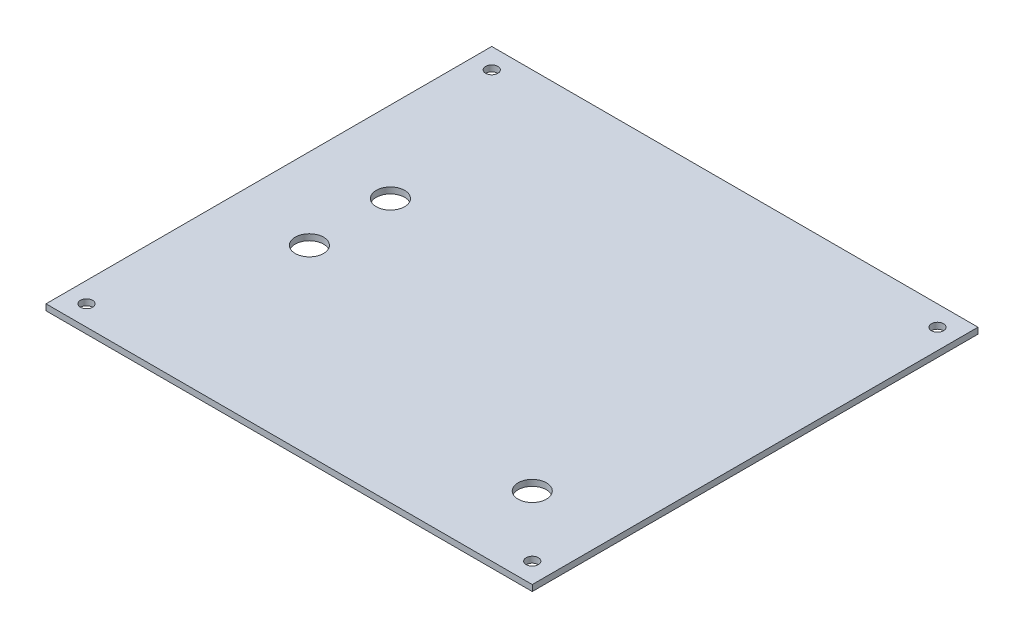
from build123d import *

# Parameters (mm, degrees)
SKETCH1_W           = 120
SKETCH1_H           = 110
SKETCH1_R           = 1.5
SKETCH1_R_2         = 3.5
BOSS_EXTRUDE1_DEPTH = 1.5


with BuildPart() as part:
    # Sketch1 → Boss-Extrude1 (new body)
    with BuildSketch(Plane(origin=(0, 0, 0), x_dir=(1, 0, 0), z_dir=(0, 1, 0))):
        with Locations((60, 55)):
            Rectangle(SKETCH1_W, SKETCH1_H)
        with Locations(Location((5, 105, 0), (0, 0, 270))):
            Circle(SKETCH1_R, mode=Mode.SUBTRACT)
        with Locations(Location((115, 105, 0), (0, 0, 270))):
            Circle(SKETCH1_R, mode=Mode.SUBTRACT)
        with Locations(Location((115, 5, 0), (0, 0, 270))):
            Circle(SKETCH1_R, mode=Mode.SUBTRACT)
        with Locations(Location((5, 5, 0), (0, 0, 270))):
            Circle(SKETCH1_R, mode=Mode.SUBTRACT)
        with Locations(Location((100, 20, 0), (0, 0, 270))):
            Circle(SKETCH1_R_2, mode=Mode.SUBTRACT)
        with Locations(Location((20, 65, 0), (0, 0, 270))):
            Circle(SKETCH1_R_2, mode=Mode.SUBTRACT)
        with Locations(Location((20, 45, 0), (0, 0, 270))):
            Circle(SKETCH1_R_2, mode=Mode.SUBTRACT)
    extrude(amount=BOSS_EXTRUDE1_DEPTH)


solid = part.part
